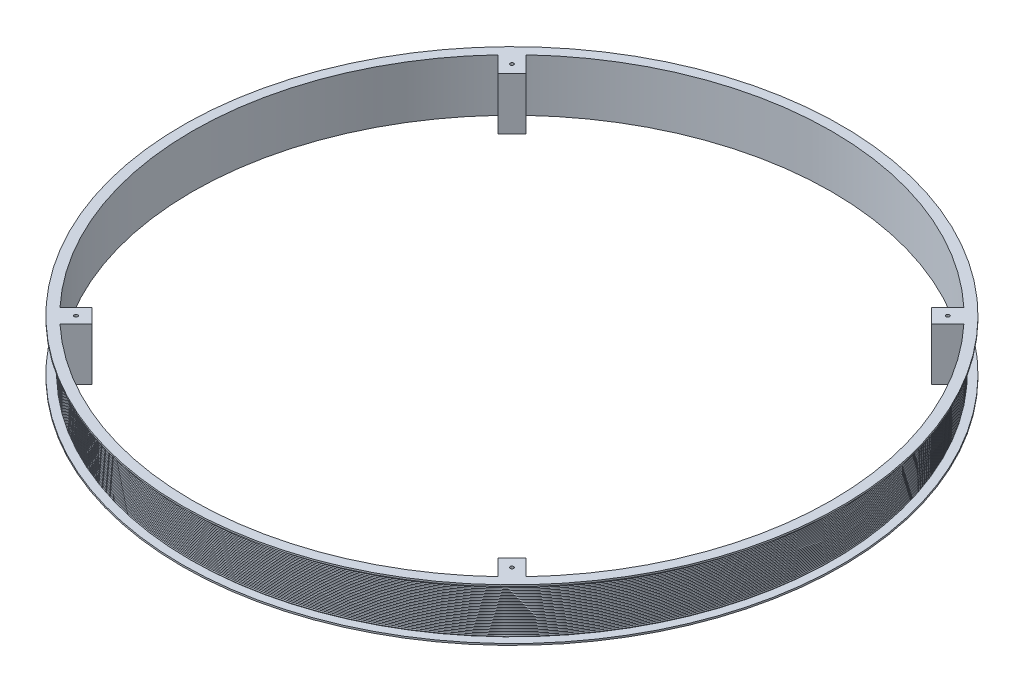
from build123d import *

# Parameters (mm, degrees)
SKETCH1_R           = 980
SKETCH1_R_2         = 975
BOSS_EXTRUDE1_DEPTH = 77.5
BOSS_EXTRUDE2_START = 82.5
SKETCH1_3_R         = 1005
SKETCH1_3_R_2       = 980
SKETCH1_3_R_3       = 975
BOSS_EXTRUDE2_DEPTH = 5
BOSS_EXTRUDE3_START = -72.5
SKETCH1_4_R         = 1005
SKETCH1_4_R_2       = 980
SKETCH1_4_R_3       = 975
BOSS_EXTRUDE3_DEPTH = 5
BOSS_EXTRUDE4_START = -77.5
SKETCH1_6_R         = 5.25
BOSS_EXTRUDE4_DEPTH = 160
SKETCH5_R           = 1.929740423
SCALE1_SCALE        = 0.5
SKETCH2_W           = 224.740849432
SKETCH2_H           = 3
CUT_EXTRUDE1_DEPTH  = 721.694428606


with BuildPart() as part:
    # Sketch1 → Boss-Extrude1 (new, symmetric)
    with BuildSketch(Plane(origin=(0, 0, 0), x_dir=(1, 0, 0), z_dir=(0, 1, 0))):
        with Locations(Location((0, 0, 0), (0, 0, 270))):
            Circle(SKETCH1_R)
        with Locations(Location((0, 0, 0), (0, 0, 270))):
            Circle(SKETCH1_R_2, mode=Mode.SUBTRACT)
    extrude(amount=BOSS_EXTRUDE1_DEPTH, both=True)

    # Sketch1<3> → Boss-Extrude2 (add)
    # profile 1 of 2: a face of its own
    with BuildSketch(Plane(origin=(0, 0, 0), x_dir=(1, 0, 0), z_dir=(0, 1, 0)).offset(BOSS_EXTRUDE2_START)):
        with Locations(Location((0, 0, 0), (0, 0, 270))):
            Circle(SKETCH1_3_R)
        with Locations(Location((0, 0, 0), (0, 0, 270))):
            Circle(SKETCH1_3_R_2, mode=Mode.SUBTRACT)
    # profile 2 of 2: a face of its own
    with BuildSketch(Plane(origin=(0, 0, 0), x_dir=(1, 0, 0), z_dir=(0, 1, 0)).offset(BOSS_EXTRUDE2_START)):
        with Locations(Location((0, 0, 0), (0, 0, 270))):
            Circle(SKETCH1_3_R_2)
        with Locations(Location((0, 0, 0), (0, 0, 270))):
            Circle(SKETCH1_3_R_3, mode=Mode.SUBTRACT)
    extrude(amount=-BOSS_EXTRUDE2_DEPTH)

    # Sketch1<4> → Boss-Extrude3 (add)
    # profile 1 of 2: a face of its own
    with BuildSketch(Plane(origin=(0, 0, 0), x_dir=(1, 0, 0), z_dir=(0, 1, 0)).offset(BOSS_EXTRUDE3_START)):
        with Locations(Location((0, 0, 0), (0, 0, 270))):
            Circle(SKETCH1_4_R)
        with Locations(Location((0, 0, 0), (0, 0, 270))):
            Circle(SKETCH1_4_R_2, mode=Mode.SUBTRACT)
    # profile 2 of 2: a face of its own
    with BuildSketch(Plane(origin=(0, 0, 0), x_dir=(1, 0, 0), z_dir=(0, 1, 0)).offset(BOSS_EXTRUDE3_START)):
        with Locations(Location((0, 0, 0), (0, 0, 270))):
            Circle(SKETCH1_4_R_2)
        with Locations(Location((0, 0, 0), (0, 0, 270))):
            Circle(SKETCH1_4_R_3, mode=Mode.SUBTRACT)
    extrude(amount=-BOSS_EXTRUDE3_DEPTH)

    # Sketch1<6> → Boss-Extrude4 (add)
    # profile 1 of 4: a face of its own
    with BuildSketch(Plane(origin=(0, 0, 0), x_dir=(1, 0, 0), z_dir=(0, 1, 0)).offset(BOSS_EXTRUDE4_START)):
        with BuildLine():
            ThreePointArc((710.315880836, 667.889473965), (689.429111657, 689.429111657), (667.889473965, 710.315880836))
            Line((667.889473965, 710.315880836), (618.718433538, 661.144840409))
            Line((618.718433538, 661.144840409), (661.144840409, 618.718433538))
            Line((661.144840409, 618.718433538), (710.315880836, 667.889473965))
        make_face()
        with Locations(Location((664.680374315, 664.680374315, 0), (0, 0, 270))):
            Circle(SKETCH1_6_R, mode=Mode.SUBTRACT)
    # profile 2 of 4: a face of its own
    with BuildSketch(Plane(origin=(0, 0, 0), x_dir=(1, 0, 0), z_dir=(0, 1, 0)).offset(BOSS_EXTRUDE4_START)):
        with BuildLine():
            Line((-618.718433538, 661.144840409), (-667.889473965, 710.315880836))
            ThreePointArc((-667.889473965, 710.315880836), (-689.429111657, 689.429111657), (-710.315880836, 667.889473964))
            Line((-710.315880836, 667.889473964), (-661.144840409, 618.718433538))
            Line((-661.144840409, 618.718433538), (-618.718433538, 661.144840409))
        make_face()
        with Locations(Location((-664.680374315, 664.680374315, 0), (0, 0, 270))):
            Circle(SKETCH1_6_R, mode=Mode.SUBTRACT)
    # profile 3 of 4: a face of its own
    with BuildSketch(Plane(origin=(0, 0, 0), x_dir=(1, 0, 0), z_dir=(0, 1, 0)).offset(BOSS_EXTRUDE4_START)):
        with BuildLine():
            Line((-661.144840409, -618.718433538), (-710.315880836, -667.889473965))
            ThreePointArc((-710.315880836, -667.889473965), (-689.429111657, -689.429111657), (-667.889473964, -710.315880836))
            Line((-667.889473964, -710.315880836), (-618.718433538, -661.14484041))
            Line((-618.718433538, -661.14484041), (-661.144840409, -618.718433538))
        make_face()
        with Locations(Location((-664.680374315, -664.680374316, 0), (0, 0, 270))):
            Circle(SKETCH1_6_R, mode=Mode.SUBTRACT)
    # profile 4 of 4: a face of its own
    with BuildSketch(Plane(origin=(0, 0, 0), x_dir=(1, 0, 0), z_dir=(0, 1, 0)).offset(BOSS_EXTRUDE4_START)):
        with BuildLine():
            ThreePointArc((667.889473965, -710.315880836), (689.429111657, -689.429111657), (710.315880836, -667.889473964))
            Line((710.315880836, -667.889473965), (661.14484041, -618.718433538))
            Line((661.14484041, -618.718433538), (618.718433538, -661.144840409))
            Line((618.718433538, -661.144840409), (667.889473965, -710.315880836))
        make_face()
        with Locations(Location((664.680374316, -664.680374315, 0), (0, 0, 270))):
            Circle(SKETCH1_6_R, mode=Mode.SUBTRACT)
    extrude(amount=BOSS_EXTRUDE4_DEPTH)

    # Sketch5 → Revolve1 (revolve)
    with BuildSketch(Plane(origin=(0, 0, 0), x_dir=(0, 0, -1), z_dir=(1, 0, 0))):
        with Locations((980, 75.285009826)):
            Circle(SKETCH5_R)
        with Locations((980, 71.285009826)):
            Circle(SKETCH5_R)
        with Locations((980, 67.285009826)):
            Circle(SKETCH5_R)
        with Locations((980, 63.285009826)):
            Circle(SKETCH5_R)
        with Locations((980, 59.285009826)):
            Circle(SKETCH5_R)
        with Locations((980, 55.285009826)):
            Circle(SKETCH5_R)
        with Locations((980, 51.285009826)):
            Circle(SKETCH5_R)
        with Locations((980, 47.285009826)):
            Circle(SKETCH5_R)
        with Locations((980, 43.285009826)):
            Circle(SKETCH5_R)
        with Locations((980, 39.285009826)):
            Circle(SKETCH5_R)
        with Locations((980, 35.285009826)):
            Circle(SKETCH5_R)
        with Locations((980, 31.285009826)):
            Circle(SKETCH5_R)
        with Locations((980, 27.285009826)):
            Circle(SKETCH5_R)
        with Locations((980, 23.285009826)):
            Circle(SKETCH5_R)
        with Locations((980, 19.285009826)):
            Circle(SKETCH5_R)
        with Locations((980, 15.285009826)):
            Circle(SKETCH5_R)
        with Locations((980, 11.285009826)):
            Circle(SKETCH5_R)
        with Locations((980, 7.285009826)):
            Circle(SKETCH5_R)
        with Locations((980, 3.285009826)):
            Circle(SKETCH5_R)
        with Locations((980, -0.714990174)):
            Circle(SKETCH5_R)
        with Locations((980, -4.714990174)):
            Circle(SKETCH5_R)
        with Locations((980, -8.714990174)):
            Circle(SKETCH5_R)
        with Locations((980, -12.714990174)):
            Circle(SKETCH5_R)
        with Locations((980, -16.714990174)):
            Circle(SKETCH5_R)
        with Locations((980, -20.714990174)):
            Circle(SKETCH5_R)
        with Locations((980, -24.714990174)):
            Circle(SKETCH5_R)
        with Locations((980, -28.714990174)):
            Circle(SKETCH5_R)
        with Locations((980, -32.714990174)):
            Circle(SKETCH5_R)
        with Locations((980, -36.714990174)):
            Circle(SKETCH5_R)
        with Locations((980, -40.714990174)):
            Circle(SKETCH5_R)
        with Locations((980, -44.714990174)):
            Circle(SKETCH5_R)
        with Locations((980, -48.714990174)):
            Circle(SKETCH5_R)
        with Locations((980, -52.714990174)):
            Circle(SKETCH5_R)
        with Locations((980, -56.714990174)):
            Circle(SKETCH5_R)
        with Locations((980, -60.714990174)):
            Circle(SKETCH5_R)
        with Locations((980, -64.714990174)):
            Circle(SKETCH5_R)
        with Locations((980, -68.714990174)):
            Circle(SKETCH5_R)
    revolve(axis=Axis((0, 0, 0), (0, 1, 0)))


with BuildPart() as part_1:
    # Scale1: scaled about (0, 2.60035912, 0)
    add(part.part.scale(SCALE1_SCALE).moved(Location((0, 1.30017956, 0))))

    # Sketch2 → Cut-Extrude1 (cut, through all)
    with BuildSketch(Plane(origin=(0, 82.5, 0), x_dir=(1, 0, 0), z_dir=(0, 1, 0))):
        with Locations((968.908849877, -48.820942868)):
            Rectangle(SKETCH2_W, SKETCH2_H)
    extrude(amount=-CUT_EXTRUDE1_DEPTH, mode=Mode.SUBTRACT)


solid = part_1.part
